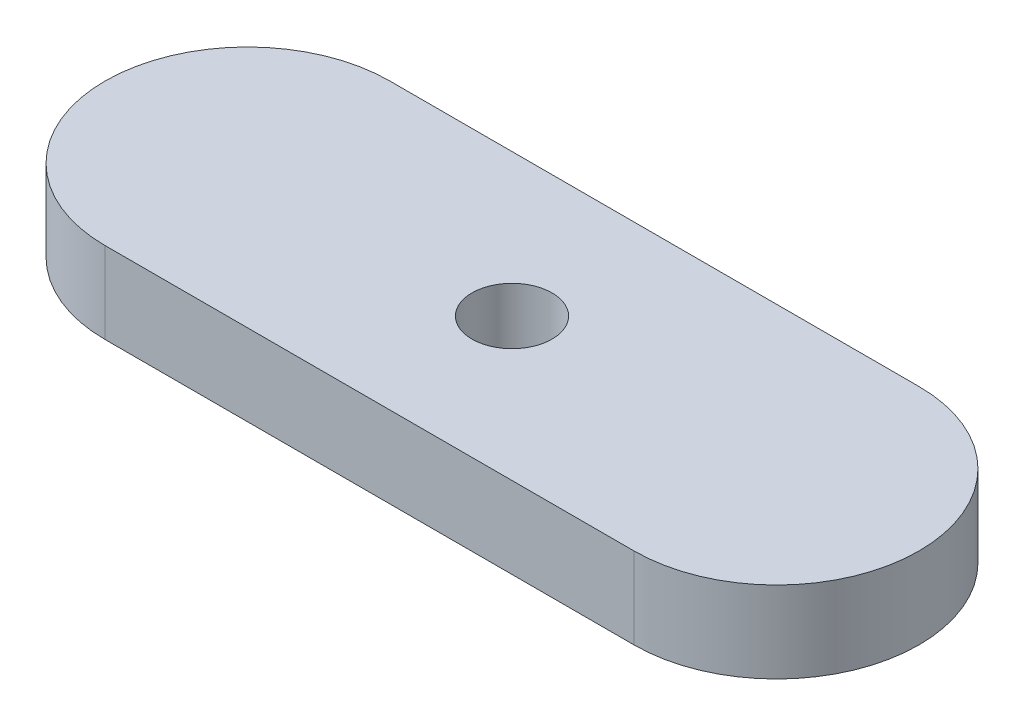
from build123d import *

# Parameters (mm, degrees)
SKETCH1_R           = 1.25
BOSS_EXTRUDE1_DEPTH = 2.54


with BuildPart() as part:
    # Sketch1 → Boss-Extrude1 (new body)
    with BuildSketch(Plane(origin=(0, 0, 0), x_dir=(1, 0, 0), z_dir=(0, 1, 0))):
        with BuildLine():
            Line((0, 4.445), (16.51, 4.445))
            ThreePointArc((16.51, 4.445), (20.955, 0), (16.51, -4.445))
            Line((16.51, -4.445), (0, -4.445))
            ThreePointArc((0, -4.445), (-4.445, 0), (0, 4.445))
        make_face()
        with Locations(Location((8.255, 0, 0), (0, 0, 270))):
            Circle(SKETCH1_R, mode=Mode.SUBTRACT)
    extrude(amount=BOSS_EXTRUDE1_DEPTH)


solid = part.part
